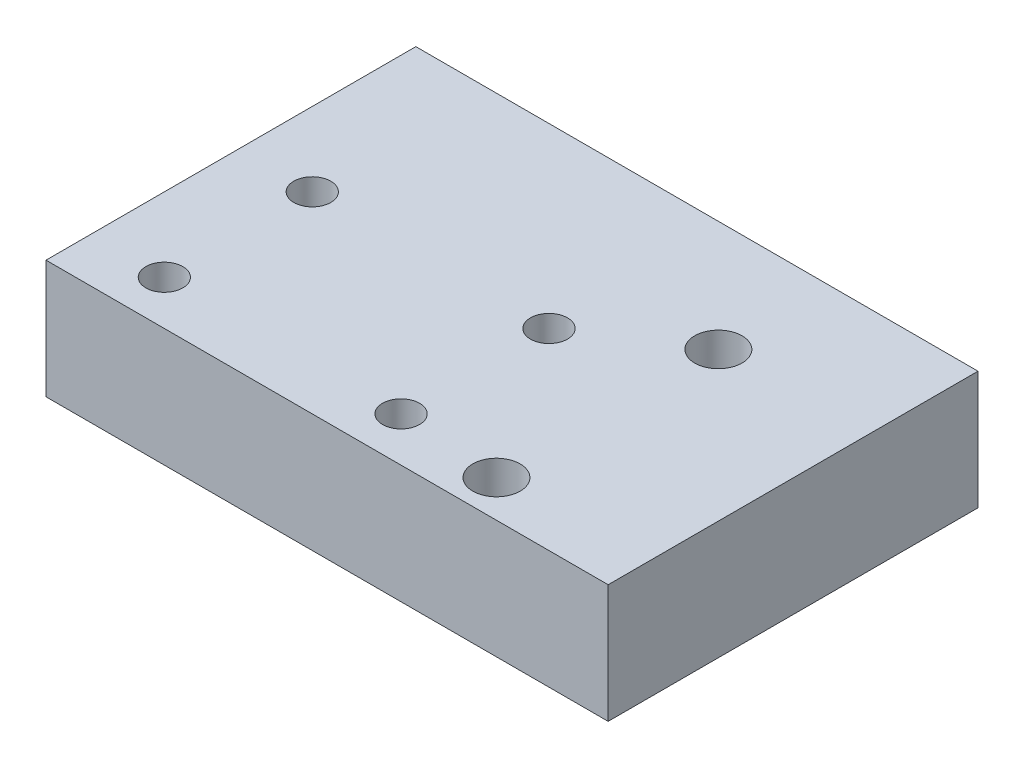
from build123d import *

# Parameters (mm, degrees)
SKETCH_1_W          = 38
SKETCH_1_H          = 25
EXTRUDE_1_DEPTH     = 8
SKETCH_2_R          = 1.25
CUT_EXTRUDE_1_DEPTH = 25.109126902
SKETCH_4_R          = 1.6
CUT_EXTRUDE_2_DEPTH = 25.109126902


with BuildPart() as part:
    # 草图1 → 凸台-拉伸1 (new body)
    with BuildSketch(Plane(origin=(0, 0, 0), x_dir=(1, 0, 0), z_dir=(0, 1, 0))):
        Rectangle(SKETCH_1_W, SKETCH_1_H)
    extrude(amount=EXTRUDE_1_DEPTH)

    # 草图2 → 切除-拉伸1 (cut, through all)
    with BuildSketch(Plane.XZ):
        with Locations(Location((2, 9.5, 0), (0, 0, 270))):
            Circle(SKETCH_2_R)
        with Locations(Location((2, -0.5, 0), (0, 0, 270))):
            Circle(SKETCH_2_R)
        with Locations(Location((-14, 9.5, 0), (0, 0, 270))):
            Circle(SKETCH_2_R)
        with Locations(Location((-14, -0.5, 0), (0, 0, 270))):
            Circle(SKETCH_2_R)
    extrude(amount=-CUT_EXTRUDE_1_DEPTH, mode=Mode.SUBTRACT)

    # 草图4 → 切除-拉伸2 (cut, through all)
    with BuildSketch(Plane.XZ):
        with Locations(Location((8.95, 10, 0), (0, 0, 270))):
            Circle(SKETCH_4_R)
        with Locations(Location((8.95, -5, 0), (0, 0, 270))):
            Circle(SKETCH_4_R)
    extrude(amount=-CUT_EXTRUDE_2_DEPTH, mode=Mode.SUBTRACT)


solid = part.part
